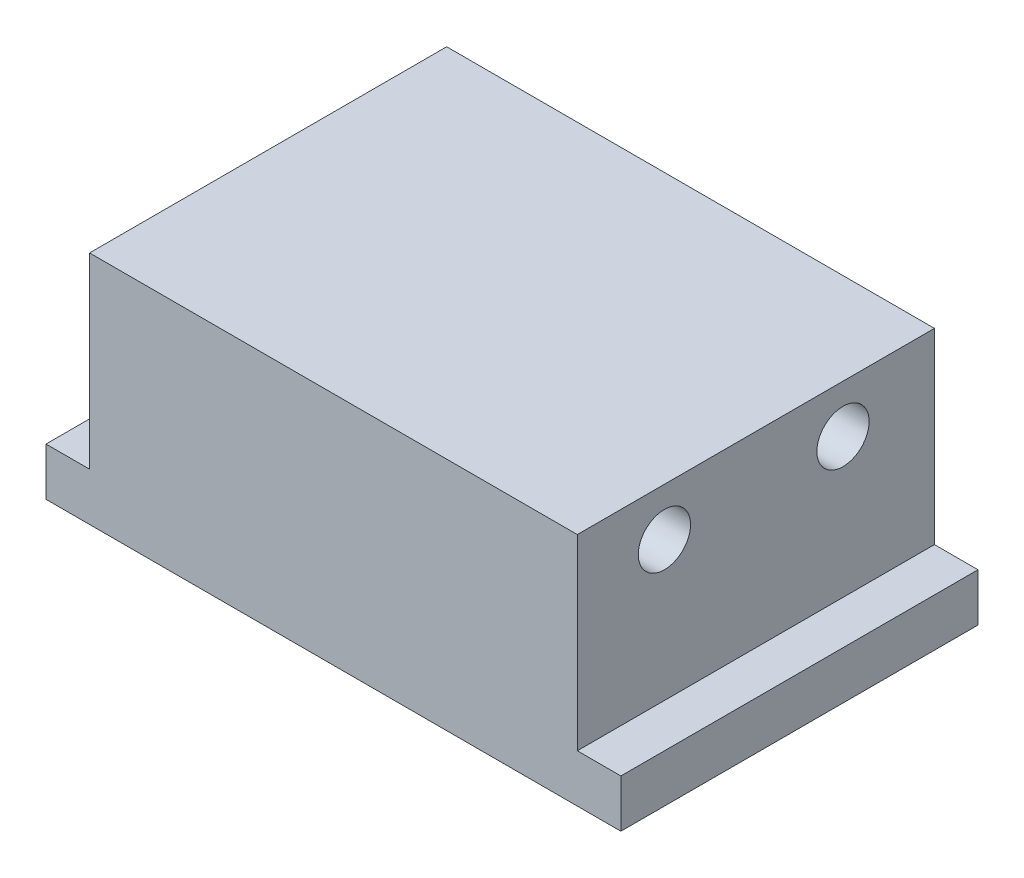
from build123d import *

# Parameters (mm, degrees)
SKETCH1_W           = 132
SKETCH1_H           = 82
BOSS_EXTRUDE1_DEPTH = 11
SKETCH2_W           = 112
SKETCH2_H           = 82
BOSS_EXTRUDE2_DEPTH = 43
SKETCH3_R           = 6
CUT_EXTRUDE1_DEPTH  = 112
SCALE1_SCALE        = 0.1


with BuildPart() as part:
    # Sketch1 → Boss-Extrude1 (new body)
    with BuildSketch(Plane(origin=(0, 0, 0), x_dir=(1, 0, 0), z_dir=(0, 1, 0))):
        with Locations((-48.872246696, 7.585903084)):
            Rectangle(SKETCH1_W, SKETCH1_H)
    extrude(amount=BOSS_EXTRUDE1_DEPTH)

    # Sketch2 → Boss-Extrude2 (add)
    with BuildSketch(Plane(origin=(0, 11, 0), x_dir=(1, 0, 0), z_dir=(0, 1, 0))):
        with Locations((-48.872246696, 7.585903084)):
            Rectangle(SKETCH2_W, SKETCH2_H)
    extrude(amount=BOSS_EXTRUDE2_DEPTH)

    # Sketch3 → Cut-Extrude1 (cut)
    with BuildSketch(Plane(origin=(7.127753304, 0, 0), x_dir=(0, 0, -1), z_dir=(1, 0, 0))):
        with Locations((-13.414096916, 43)):
            Circle(SKETCH3_R)
        with Locations((27.585903084, 43)):
            Circle(SKETCH3_R)
    extrude(amount=-CUT_EXTRUDE1_DEPTH, mode=Mode.SUBTRACT)


with BuildPart() as part_1:
    # Scale1: scaled about (-48.872246696, 25.376724614, -7.611825736)
    add(part.part.scale(SCALE1_SCALE).moved(Location((-43.985022026, 22.839052153, -6.850643162))))


solid = part_1.part
